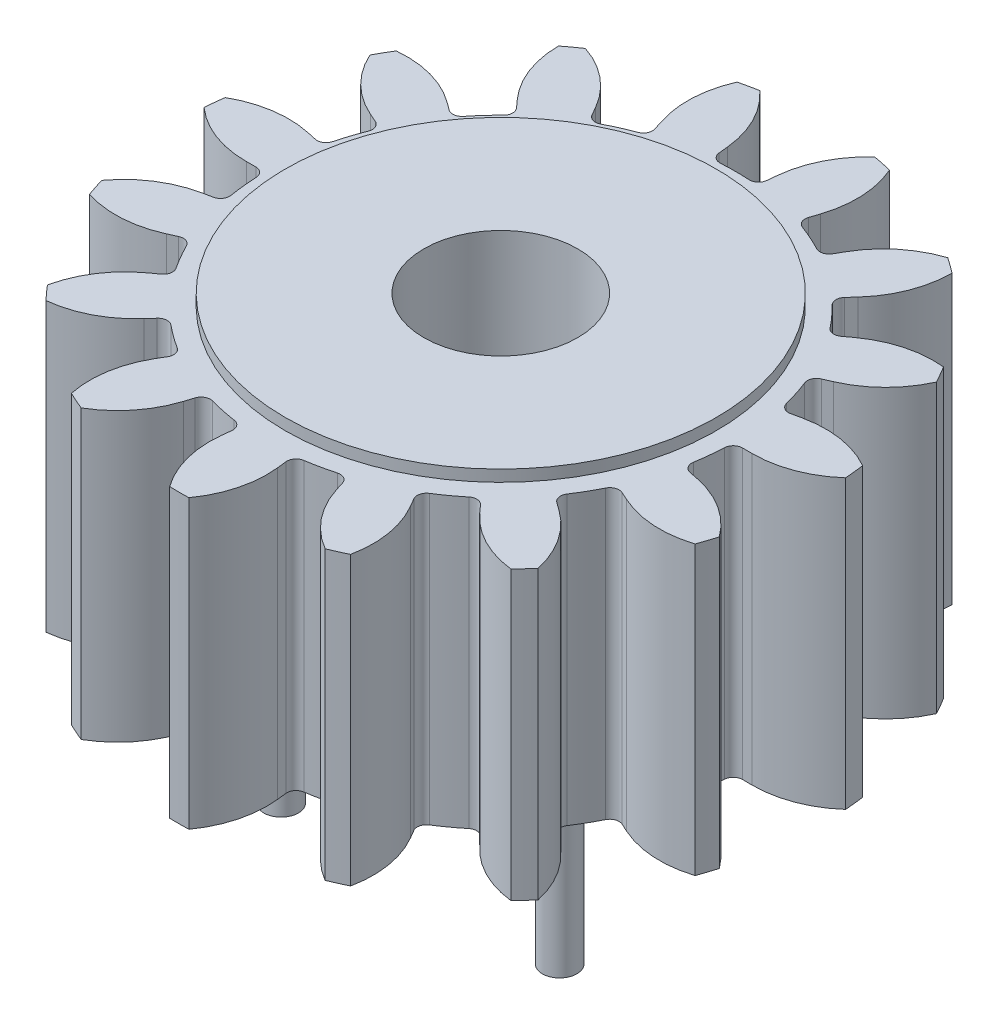
from build123d import *

# Parameters (mm, degrees)
SKETCH1_R                = 3.556
BOSS_EXTRUDE1_DEPTH      = 3.175
SKETCH2_R                = 2.38125
BOSS_EXTRUDE2_DEPTH      = 0.127
CUT_EXTRUDE3_DEPTH       = 6.947343693
FILLET1_R                = 0.1016
CIRPATTERN3_COUNT        = 15
FILLET1_OF_CIRPATTERN3_R = 0.1016
SKETCH5_R                = 0.8509
CUT_EXTRUDE2_DEPTH       = 3.302
SKETCH6_R                = 0.1905
BOSS_EXTRUDE3_DEPTH      = 1.905
CIRPATTERN2_COUNT        = 3


with BuildPart() as part:
    # Sketch1 → Boss-Extrude1 (new body)
    with BuildSketch(Plane(origin=(0, 0, 0), x_dir=(1, 0, 0), z_dir=(0, 1, 0))):
        with Locations(Location((0, 0, 0), (0, 0, 270))):
            Circle(SKETCH1_R)
    extrude(amount=BOSS_EXTRUDE1_DEPTH)

    # Sketch2 → Boss-Extrude2 (add)
    with BuildSketch(Plane(origin=(0, 3.175, 0), x_dir=(1, 0, 0), z_dir=(0, 1, 0))):
        with Locations(Location((0, 0, 0), (0, 0, 270))):
            Circle(SKETCH2_R)
    extrude(amount=BOSS_EXTRUDE2_DEPTH)

    # Sketch8 → Cut-Extrude3 (cut, through all)
    with BuildSketch(Plane(origin=(0, 3.175, 0), x_dir=(1, 0, 0), z_dir=(0, 1, 0))):
        with BuildLine():
            Line((-0.273921569, 2.780540051), (-0.254, 2.578318956))
            ThreePointArc((-0.254, 2.578318956), (0, 2.5908), (0.254, 2.578318956))
            Line((0.254, 2.578318956), (0.273921569, 2.780540051))
            ThreePointArc((0.273921569, 2.780540051), (0.38769625, 3.17325346), (0.635, 3.498844238))
            ThreePointArc((0.635, 3.498844238), (0, 3.556), (-0.635, 3.498844238))
            ThreePointArc((-0.635, 3.498844238), (-0.38769625, 3.17325346), (-0.273921569, 2.780540051))
        make_face()
    cut_extrude3 = extrude(amount=-CUT_EXTRUDE3_DEPTH, mode=Mode.SUBTRACT)

    # Fillet1
    fillet1_edges = [part.edges().sort_by_distance(p)[0] for p in [
        (0.254, 1.5875, -2.578318956),
        (-0.254, 1.5875, -2.578318956),
    ]]
    fillet(fillet1_edges, radius=FILLET1_R)

    # CirPattern3: Cut-Extrude3 ×15 about axis
    cirpattern3_axis = Axis((0, 0, 0), (0, 1, 0))
    for i in range(1, CIRPATTERN3_COUNT):
        add(cut_extrude3.rotate(cirpattern3_axis, i * 360 / CIRPATTERN3_COUNT), mode=Mode.SUBTRACT)

    # Fillet1 of CirPattern3
    fillet1_of_cirpattern3_edges = [part.edges().sort_by_distance(p)[0] for p in [
        (-0.816656251, 1.5875, -2.458722678),
        (-1.280737343, 1.5875, -2.252100463),
        (-1.746105217, 1.5875, -1.913990912),
        (-2.086023565, 1.5875, -1.536473341),
        (-2.373636728, 1.5875, -1.03831273),
        (-2.530617361, 1.5875, -0.555176019),
        (-2.590744885, 1.5875, 0.016899157),
        (-2.537644426, 1.5875, 0.52211628),
        (-2.359889715, 1.5875, 1.069189026),
        (-2.105889715, 1.5875, 1.509129931),
        (-1.720988175, 1.5875, 1.936606398),
        (-1.310007542, 1.5875, 2.235201307),
        (-0.784512144, 1.5875, 2.469166931),
        (-0.287613163, 1.5875, 2.57478607),
        (0.287613163, 1.5875, 2.57478607),
        (0.784512144, 1.5875, 2.469166931),
        (1.310007542, 1.5875, 2.235201307),
        (1.720988175, 1.5875, 1.936606398),
        (2.105889715, 1.5875, 1.509129931),
        (2.359889715, 1.5875, 1.069189026),
        (2.537644426, 1.5875, 0.52211628),
        (2.590744885, 1.5875, 0.016899157),
        (2.530617361, 1.5875, -0.555176019),
        (2.373636728, 1.5875, -1.03831273),
        (2.086023565, 1.5875, -1.536473341),
        (1.746105217, 1.5875, -1.913990912),
        (1.280737343, 1.5875, -2.252100463),
        (0.816656251, 1.5875, -2.458722678),
    ]]
    fillet(fillet1_of_cirpattern3_edges, radius=FILLET1_OF_CIRPATTERN3_R)

    # Sketch5 → Cut-Extrude2 (cut)
    with BuildSketch(Plane.XZ):
        with Locations(Location((0, 0, 0), (0, 0, 270))):
            Circle(SKETCH5_R)
    extrude(amount=-CUT_EXTRUDE2_DEPTH, mode=Mode.SUBTRACT)

    # Sketch6 → Boss-Extrude3 (add)
    with BuildSketch(Plane.XZ):
        with Locations(Location((0, -1.778, 0), (0, 0, 90))):
            Circle(SKETCH6_R)
    boss_extrude3 = extrude(amount=BOSS_EXTRUDE3_DEPTH)

    # CirPattern2: Boss-Extrude3 ×3 about axis
    cirpattern2_axis = Axis((0, 0, 0), (0, 1, 0))
    for i in range(1, CIRPATTERN2_COUNT):
        add(boss_extrude3.rotate(cirpattern2_axis, i * 360 / CIRPATTERN2_COUNT))


solid = part.part
